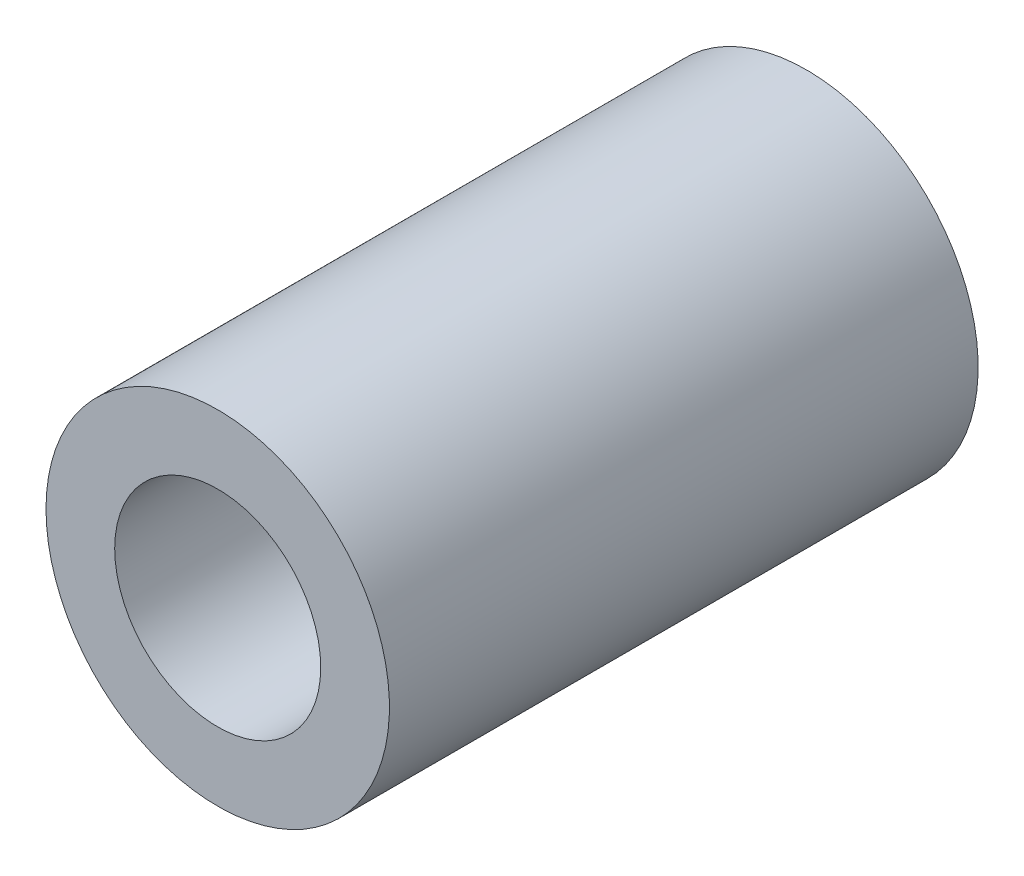
from build123d import *

# Parameters (mm, degrees)
SKETCH1_W = 2.8
SKETCH1_H = 24


with BuildPart() as part:
    # Sketch1 → Revolve1 (revolve)
    with BuildSketch(Plane.XZ, mode=Mode.PRIVATE) as revolve1_sk:
        with Locations((5.6, 12)):
            Rectangle(SKETCH1_W, SKETCH1_H)
    revolve(revolve1_sk.sketch.rotate(Axis((0, 0, 24), (0, 0, -1)), 180), axis=Axis((0, 0, 24), (0, 0, -1)))


solid = part.part
